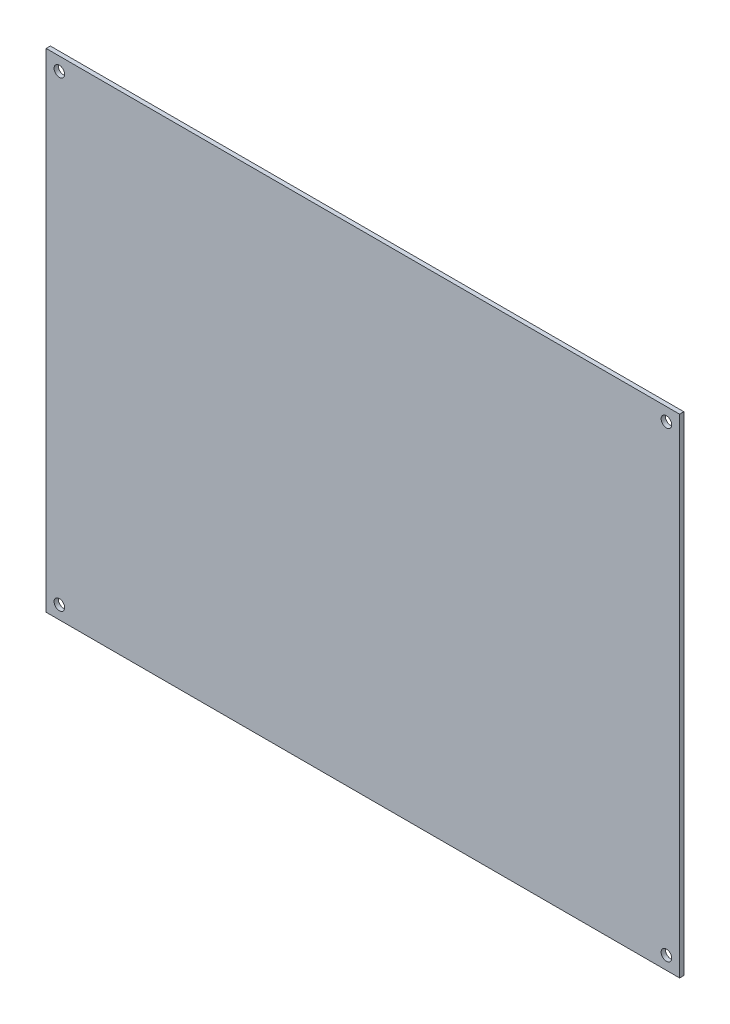
from build123d import *

# Parameters (mm, degrees)
SKETCH1_W           = 240
SKETCH1_H           = 185
SKETCH1_R           = 2
BOSS_EXTRUDE1_DEPTH = 1.6


with BuildPart() as part:
    # Sketch1 → Boss-Extrude1 (new body)
    with BuildSketch(Plane.XY):
        Rectangle(SKETCH1_W, SKETCH1_H)
        with Locations((115, 87.5)):
            Circle(SKETCH1_R, mode=Mode.SUBTRACT)
        with Locations(Location((115, -87.5, 0), (0, 0, 180))):
            Circle(SKETCH1_R, mode=Mode.SUBTRACT)
        with Locations((-115, -87.5)):
            Circle(SKETCH1_R, mode=Mode.SUBTRACT)
        with Locations(Location((-115, 87.5, 0), (0, 0, 180))):
            Circle(SKETCH1_R, mode=Mode.SUBTRACT)
    extrude(amount=BOSS_EXTRUDE1_DEPTH)


solid = part.part
